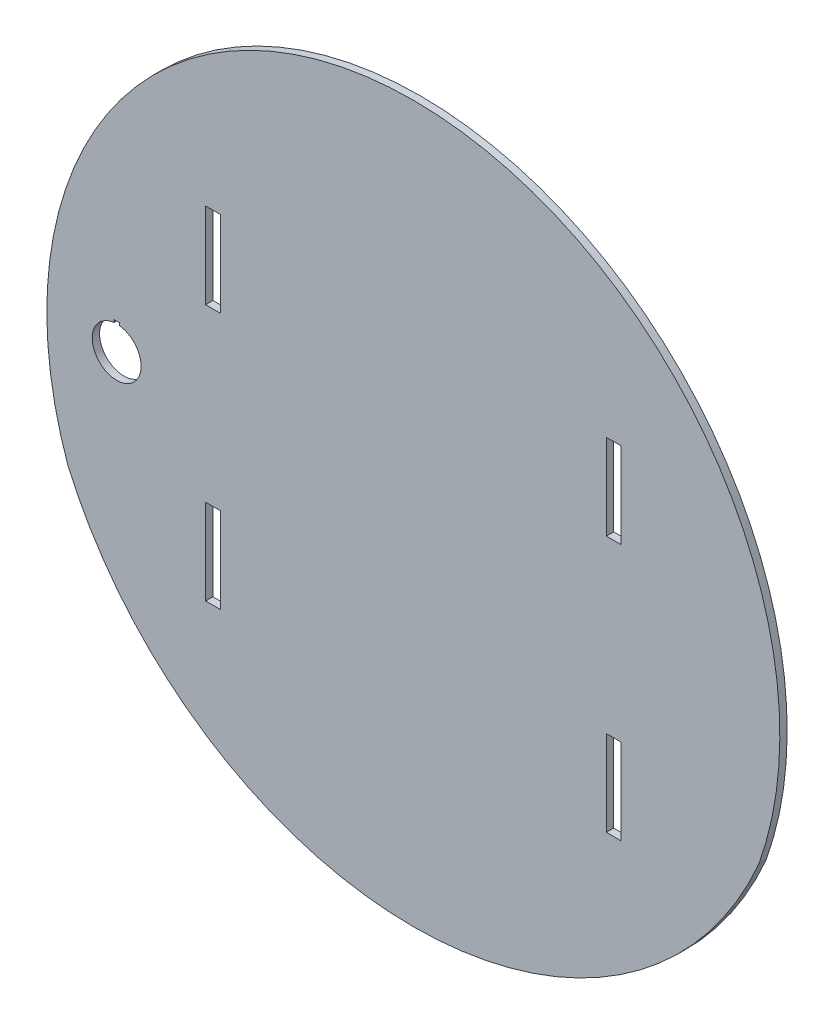
from build123d import *

# Parameters (mm, degrees)
ESBO_O1_W                = 6
ESBO_O1_H                = 35
RESSALTO_EXTRUS_O1_DEPTH = 3


with BuildPart() as part:
    # Esboço1 → Ressalto-extrusão1 (new body)
    with BuildSketch(Plane.XY):
        with BuildLine():
            ThreePointArc((141.421356237, -50), (0, 150), (-141.421356237, -50))
            ThreePointArc((-141.421356237, -50), (0, -142.957457878), (141.421356237, -50))
        make_face()
        with BuildLine():
            Line((-120.321356237, 11), (-122.521356237, 11))
            Line((-122.521356237, 11), (-122.521356237, 9.939315872))
            ThreePointArc((-122.521356237, 9.939315872), (-121.421356237, -10), (-120.321356237, 9.939315872))
            Line((-120.321356237, 9.939315872), (-120.321356237, 11))
        make_face(mode=Mode.SUBTRACT)
        with Locations((-82, -52.5)):
            Rectangle(ESBO_O1_W, ESBO_O1_H, mode=Mode.SUBTRACT)
        with Locations((-82, 52.5)):
            Rectangle(ESBO_O1_W, ESBO_O1_H, mode=Mode.SUBTRACT)
        with Locations((82, -52.5)):
            Rectangle(ESBO_O1_W, ESBO_O1_H, mode=Mode.SUBTRACT)
        with Locations((82, 52.5)):
            Rectangle(ESBO_O1_W, ESBO_O1_H, mode=Mode.SUBTRACT)
    extrude(amount=RESSALTO_EXTRUS_O1_DEPTH)


solid = part.part
